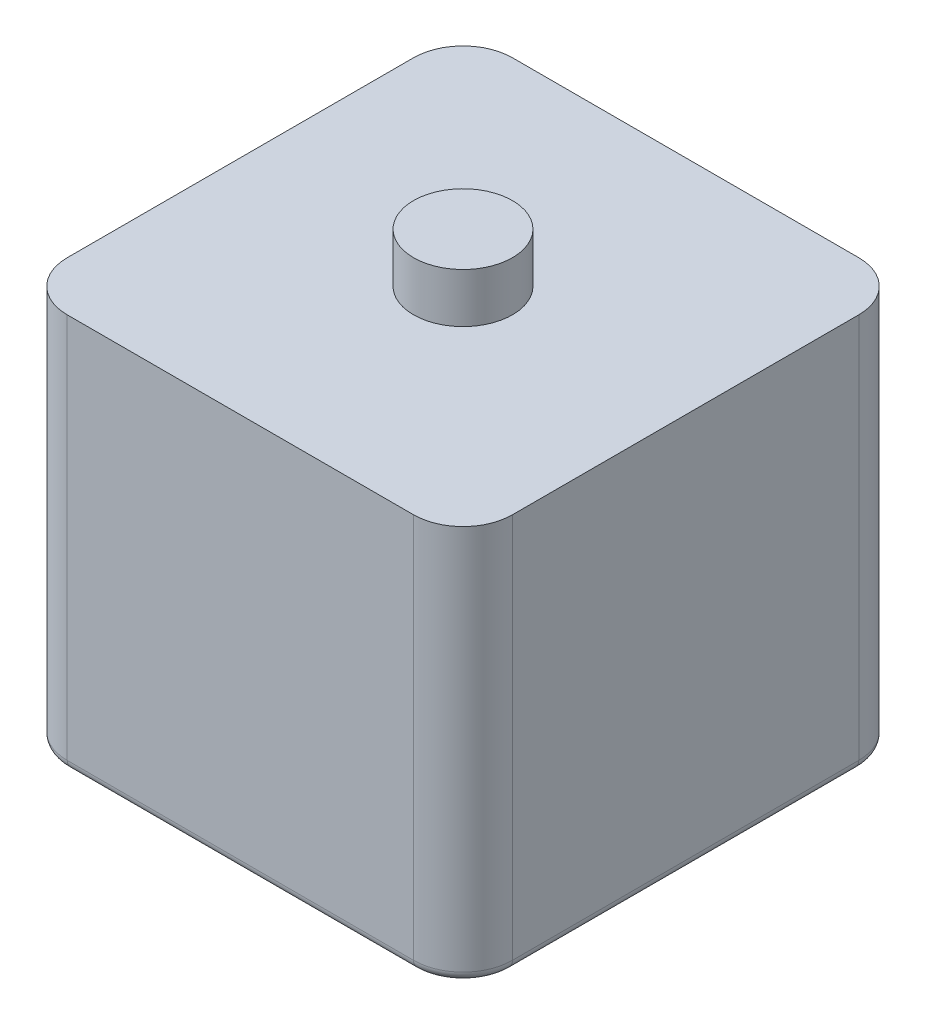
from build123d import *

# Parameters (mm, degrees)
CROQUIS1_W     = 45
CROQUIS1_H     = 45
EXTRUIR1_DEPTH = 40
CROQUIS2_R     = 5
EXTRUIR2_DEPTH = 10
REDONDEO1_R    = 5
CROQUIS3_R     = 15
EXTRUIR3_DEPTH = 5
REDONDEO2_R    = 2
REDONDEO3_R    = 1
CROQUIS4_R     = 4
EXTRUIR4_DEPTH = 1
CROQUIS5_R     = 5
EXTRUIR5_DEPTH = 5


with BuildPart() as part:
    # Croquis1 → Extruir1 (new body)
    with BuildSketch(Plane(origin=(0, 0, 0), x_dir=(1, 0, 0), z_dir=(0, 1, 0))):
        Rectangle(CROQUIS1_W, CROQUIS1_H)
    extrude(amount=EXTRUIR1_DEPTH)

    # Croquis2 → Extruir2 (cut)
    with BuildSketch(Plane(origin=(0, 40, 0), x_dir=(1, 0, 0), z_dir=(0, 1, 0))):
        with Locations(Location((0, 0, 0), (0, 0, 270))):
            Circle(CROQUIS2_R)
    extrude(amount=-EXTRUIR2_DEPTH, mode=Mode.SUBTRACT)

    # Redondeo1
    redondeo1_edges = [part.edges().sort_by_distance(p)[0] for p in [
        (-22.5, 20, -22.5),
        (22.5, 20, -22.5),
        (22.5, 20, 22.5),
        (-22.5, 20, 22.5),
    ]]
    fillet(redondeo1_edges, radius=REDONDEO1_R)

    # Croquis3 → Extruir3 (add)
    with BuildSketch(Plane.XZ):
        with Locations(Location((0, 0, 0), (0, 0, 90))):
            Circle(CROQUIS3_R)
    extrude(amount=EXTRUIR3_DEPTH)

    # Redondeo2
    redondeo2_edges = [part.edges().sort_by_distance(p)[0] for p in [
        (0, -5, -15),
    ]]
    fillet(redondeo2_edges, radius=REDONDEO2_R)

    # Redondeo3
    redondeo3_edges = [part.edges().sort_by_distance(p)[0] for p in [
        (-22.5, 0, 0),
        (0, 0, -22.5),
        (22.5, 0, 0),
        (0, 0, 22.5),
        (-21.035533906, 0, 21.035533906),
        (21.035533906, 0, 21.035533906),
        (21.035533906, 0, -21.035533906),
        (-21.035533906, 0, -21.035533906),
        (0, 0, -15),
    ]]
    fillet(redondeo3_edges, radius=REDONDEO3_R)

    # Croquis4 → Extruir4 (cut)
    with BuildSketch(Plane.XZ.offset(5)):
        with Locations(Location((0, 0, 0), (0, 0, 270))):
            Circle(CROQUIS4_R)
    extrude(amount=-EXTRUIR4_DEPTH, mode=Mode.SUBTRACT)


with BuildPart() as body_2:
    # Croquis5 → Extruir5 (new body)
    with BuildSketch(Plane(origin=(0, 40, 0), x_dir=(1, 0, 0), z_dir=(0, 1, 0))):
        with Locations(Location((0, 0, 0), (0, 0, 270))):
            Circle(CROQUIS5_R)
    extrude(amount=EXTRUIR5_DEPTH)


solid = Compound([part.part, body_2.part])
